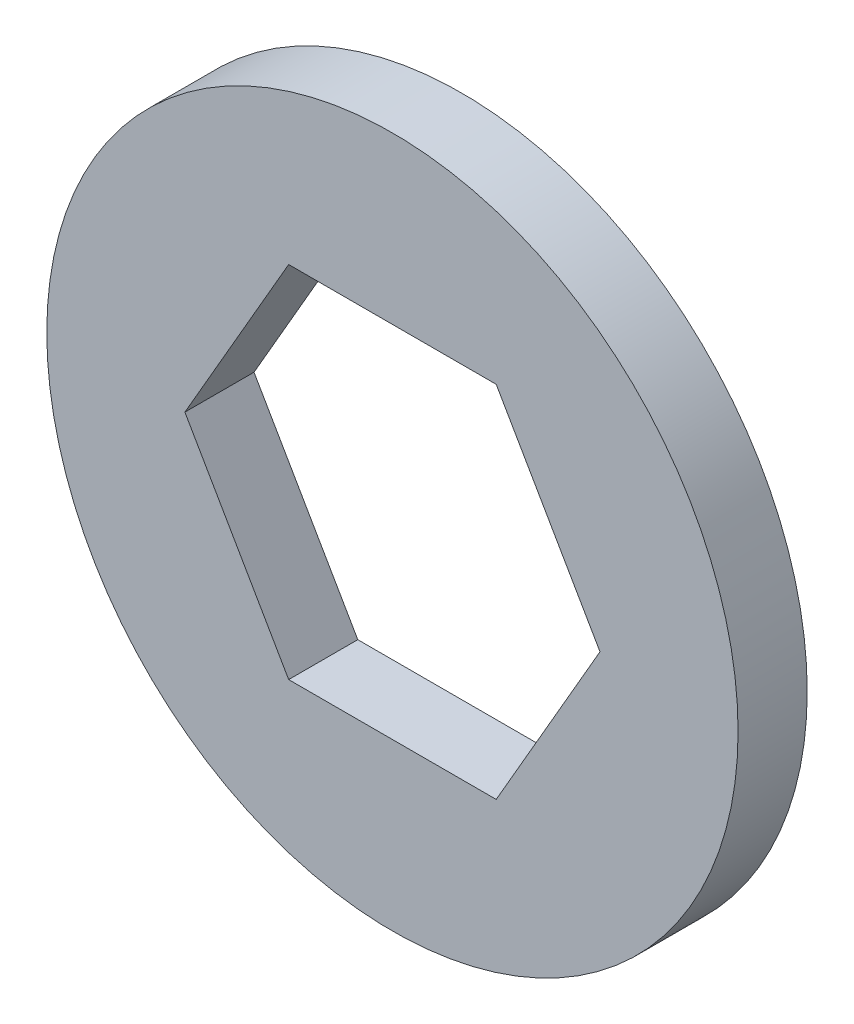
from build123d import *

# Parameters (mm, degrees)
SKETCH1_R           = 12.7
BOSS_EXTRUDE1_DEPTH = 2.54


with BuildPart() as part:
    # Sketch1 → Boss-Extrude1 (new body)
    with BuildSketch(Plane.XY):
        Circle(SKETCH1_R)
        Polygon((3.812821178, -6.604), (7.625642355, 0), (3.812821178, 6.604), (-3.812821178, 6.604), (-7.625642355, 0), (-3.812821178, -6.604), align=None, mode=Mode.SUBTRACT)
    extrude(amount=BOSS_EXTRUDE1_DEPTH)


solid = part.part
